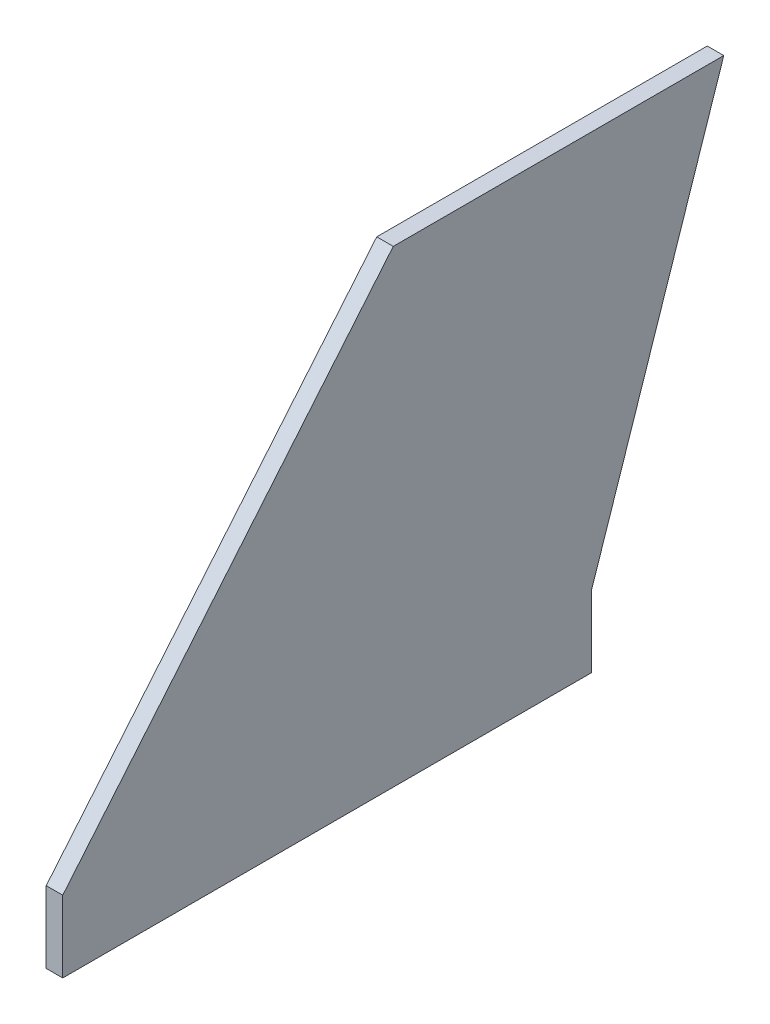
from build123d import *

# Parameters (mm, degrees)
BOSS_EXTRU_1_DEPTH = 6.35


with BuildPart() as part:
    # Esquisse2 → Boss.-Extru.1 (new body)
    with BuildSketch(Plane(origin=(0, 0, 0), x_dir=(0, 0, -1), z_dir=(1, 0, 0))):
        Polygon((-203.2, 0), (-203.2, -27.559), (0, -27.559), (0, 0), (50.8, 152.4), (-76.2, 152.4), align=None)
    extrude(amount=BOSS_EXTRU_1_DEPTH)


solid = part.part
